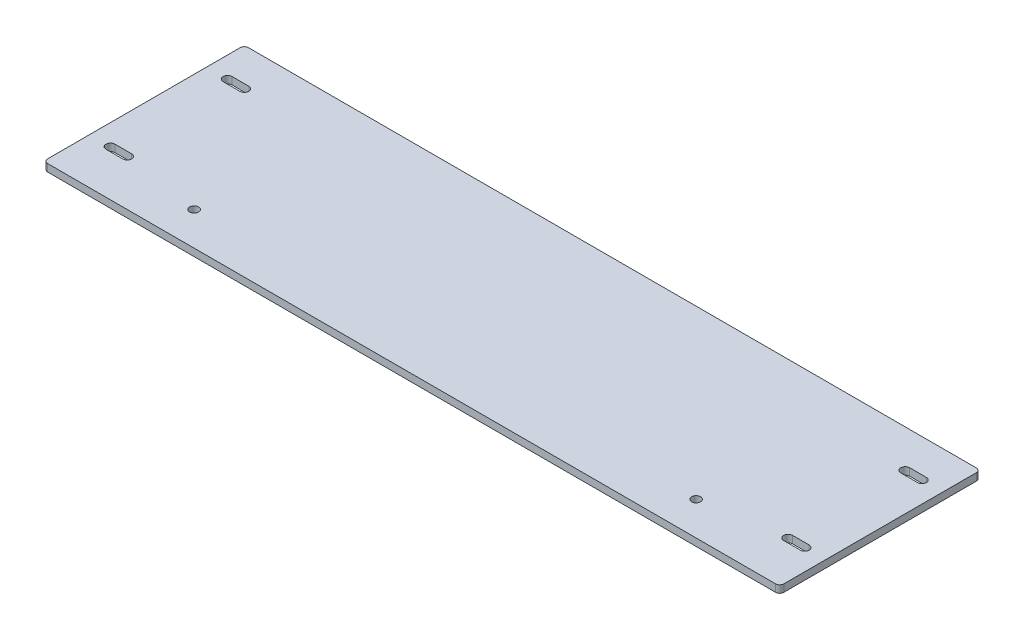
from build123d import *

# Parameters (mm, degrees)
SKETCH1_W           = 558.8
SKETCH1_H           = 152.4
BOSS_EXTRUDE1_DEPTH = 5.588
FILLET1_R           = 3.175
SKETCH2_R           = 3.3782
CUT_EXTRUDE1_DEPTH  = 580.236070824


with BuildPart() as part:
    # Sketch1 → Boss-Extrude1 (new body)
    with BuildSketch(Plane(origin=(0, 0, 0), x_dir=(1, 0, 0), z_dir=(0, 1, 0))):
        with Locations((279.4, 76.2)):
            Rectangle(SKETCH1_W, SKETCH1_H)
        with BuildLine():
            Line((15.875, 38.3032), (28.575, 38.3032))
            ThreePointArc((28.575, 38.3032), (31.9532, 34.925), (28.575, 31.5468))
            Line((28.575, 31.5468), (15.875, 31.5468))
            ThreePointArc((15.875, 31.5468), (12.4968, 34.925), (15.875, 38.3032))
        make_face(mode=Mode.SUBTRACT)
        with BuildLine():
            Line((15.875, 127.2032), (28.575, 127.2032))
            ThreePointArc((28.575, 127.2032), (31.9532, 123.825), (28.575, 120.4468))
            Line((28.575, 120.4468), (15.875, 120.4468))
            ThreePointArc((15.875, 120.4468), (12.4968, 123.825), (15.875, 127.2032))
        make_face(mode=Mode.SUBTRACT)
        with BuildLine():
            Line((542.925, 120.4468), (530.225, 120.4468))
            ThreePointArc((530.225, 120.4468), (526.8468, 123.825), (530.225, 127.2032))
            Line((530.225, 127.2032), (542.925, 127.2032))
            ThreePointArc((542.925, 127.2032), (546.3032, 123.825), (542.925, 120.4468))
        make_face(mode=Mode.SUBTRACT)
        with BuildLine():
            Line((542.925, 31.5468), (530.225, 31.5468))
            ThreePointArc((530.225, 31.5468), (526.8468, 34.925), (530.225, 38.3032))
            Line((530.225, 38.3032), (542.925, 38.3032))
            ThreePointArc((542.925, 38.3032), (546.3032, 34.925), (542.925, 31.5468))
        make_face(mode=Mode.SUBTRACT)
    extrude(amount=BOSS_EXTRUDE1_DEPTH)

    # Fillet1
    fillet1_edges = [part.edges().sort_by_distance(p)[0] for p in [
        (0, 2.794, -152.4),
        (558.8, 2.794, -152.4),
        (558.8, 2.794, 0),
        (0, 2.794, 0),
    ]]
    fillet(fillet1_edges, radius=FILLET1_R)

    # Sketch2 → Cut-Extrude1 (cut, through all)
    with BuildSketch(Plane(origin=(0, 5.588, 0), x_dir=(1, 0, 0), z_dir=(0, 1, 0))):
        with Locations(Location((88.9, 25.4, 0), (0, 0, 270))):
            Circle(SKETCH2_R)
        with Locations(Location((469.9, 25.4, 0), (0, 0, 270))):
            Circle(SKETCH2_R)
    extrude(amount=-CUT_EXTRUDE1_DEPTH, mode=Mode.SUBTRACT)


solid = part.part
